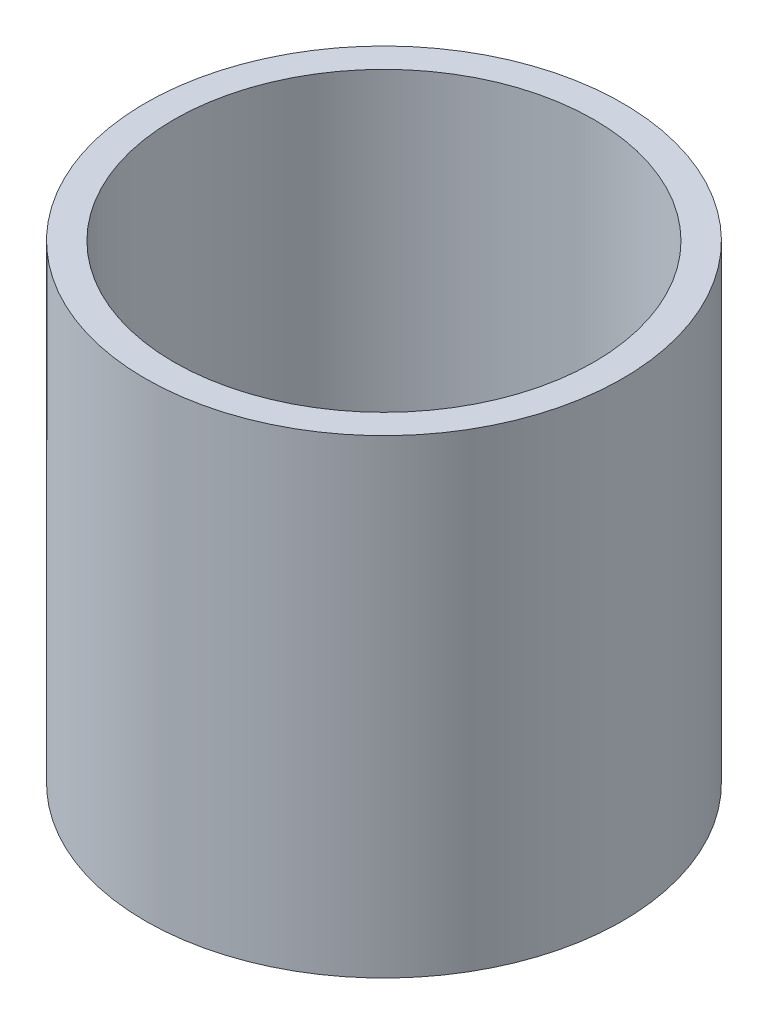
from build123d import *

# Parameters (mm, degrees)
SKETCH1_R           = 50.8
SKETCH1_R_2         = 44.7167
BOSS_EXTRUDE1_DEPTH = 100


with BuildPart() as part:
    # Sketch1 → Boss-Extrude1 (new body)
    with BuildSketch(Plane(origin=(0, 0, 0), x_dir=(1, 0, 0), z_dir=(0, 1, 0))):
        with Locations(Location((0, 0, 0), (0, 0, 270))):
            Circle(SKETCH1_R)
        with Locations(Location((0, 0, 0), (0, 0, 270))):
            Circle(SKETCH1_R_2, mode=Mode.SUBTRACT)
    extrude(amount=BOSS_EXTRUDE1_DEPTH)


solid = part.part
